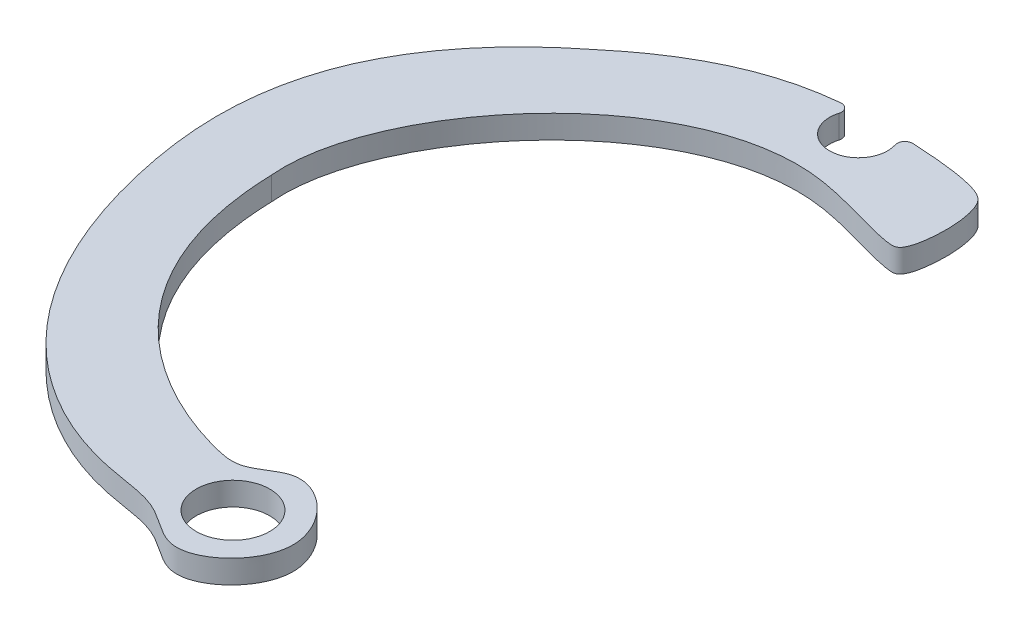
from build123d import *

# Parameters (mm, degrees)
BOSS_EXTRUDE1_DEPTH = 3
SKETCH2_R           = 4.75
CUT_EXTRUDE1_DEPTH  = 3
SKETCH3_R           = 3.75
CUT_EXTRUDE2_DEPTH  = 6
FILLET1_R           = 1


with BuildPart() as part:
    # Sketch1 → Boss-Extrude1 (new body)
    with BuildSketch(Plane(origin=(0, 0, 0), x_dir=(1, 0, 0), z_dir=(0, 1, 0))):
        with BuildLine():
            add(Edge.make_bspline(
                [(-35, 0), (-36.359516326, 14.831072325), (-14.184057163, 42.361645641), (10.123763675, 32.260238564), (14.709769121, 32.064295249), (15.173904313, 40.818240015), (12.273361417, 44.162560977), (0.297772143, 45.556309898), (-16.539572512, 44.620048114), (-28, 35)],
                knots=[0, 0, 0, 0, 0.643737264, 0.804497462, 0.830880646, 0.899048166, 0.911986837, 0.95174642, 1, 1, 1, 1], degree=3))
            add(Edge.make_bspline(
                [(-28, 35), (-46.329108557, 20.639162327), (-47.076220818, -19.703464495), (-25.747036949, -42.347322679), (-5.088451666, -44.169040026), (0.849917635, -50.480006168), (12.116221023, -40.168721851), (1.250584011, -29.35962859), (-3.769244573, -34.970952953), (-12.926178672, -33.461838009), (-34.2949665, -24.395875385), (-35, 0)],
                knots=[0, 0, 0, 0, 0.209603549, 0.538531046, 0.585123303, 0.634410174, 0.719791183, 0.805172192, 0.847140401, 0.866623182, 1, 1, 1, 1], degree=3))
        make_face()
    extrude(amount=BOSS_EXTRUDE1_DEPTH)

    # Sketch2 → Cut-Extrude1 (cut)
    with BuildSketch(Plane(origin=(0, 3, 0), x_dir=(1, 0, 0), z_dir=(0, 1, 0))):
        with Locations(Location((0, -40, 0), (0, 0, 270))):
            Circle(SKETCH2_R)
    extrude(amount=-CUT_EXTRUDE1_DEPTH, mode=Mode.SUBTRACT)

    # Sketch3 → Cut-Extrude2 (cut)
    with BuildSketch(Plane(origin=(0, 3, 0), x_dir=(1, 0, 0), z_dir=(0, 1, 0))):
        with Locations((-1.673386239, 42.45481762)):
            Circle(SKETCH3_R)
    extrude(amount=-CUT_EXTRUDE2_DEPTH, mode=Mode.SUBTRACT)

    # Fillet1
    fillet1_edges = [part.edges().sort_by_distance(p)[0] for p in [
        (-4.479465428, 1.5, -44.94247105),
        (1.103946658, 1.5, -44.974524345),
    ]]
    fillet(fillet1_edges, radius=FILLET1_R)


solid = part.part
